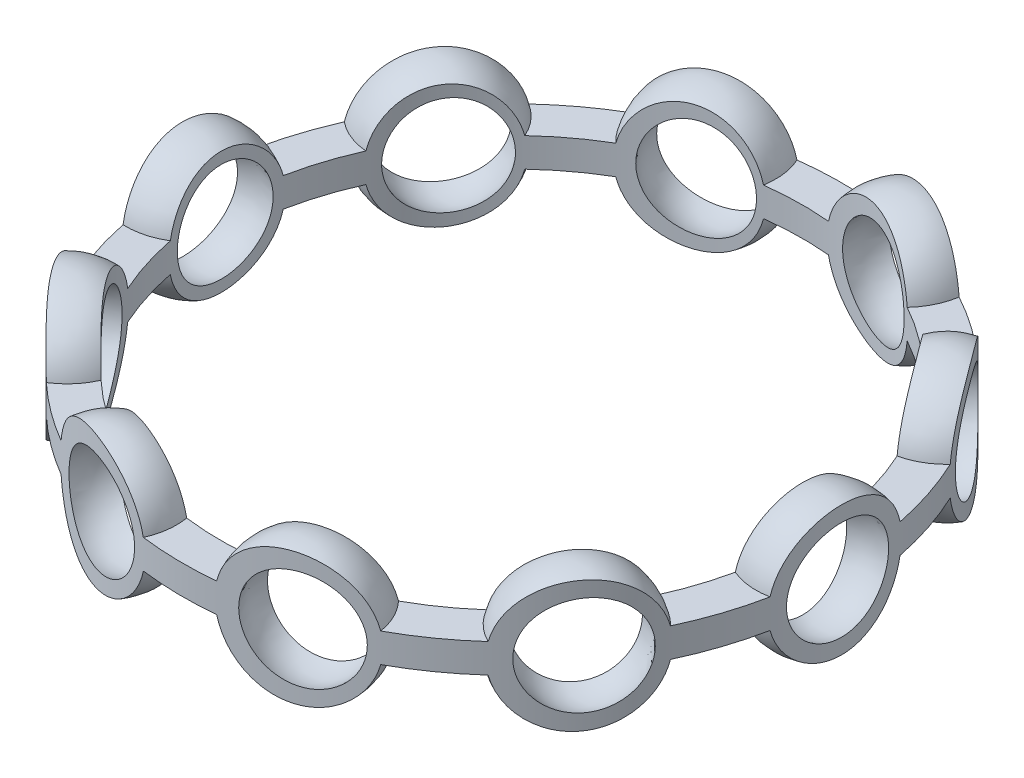
from build123d import *

# Parameters (mm, degrees)
SKETCH_1_R               = 27.5
EXTRUDE_1_DEPTH          = 0.75
PATTERN_CIRCULAR_1_COUNT = 10
SKETCH_5_OUTSIDE_W       = 72.62
SKETCH_5_OUTSIDE_H       = 72.62
SKETCH_5_OUTSIDE_R       = 17
SKETCH_5_OUTSIDE_R_2     = 15
CUT_EXTRUDE_1_DEPTH      = 5
PATTERN_CIRCULAR_2_COUNT = 10


with BuildPart() as part:
    # 草图1 → 凸台-拉伸1 (new, symmetric)
    with BuildSketch(Plane(origin=(0, 0, 0), x_dir=(1, 0, 0), z_dir=(0, 1, 0))):
        with Locations(Location((0, 0, 0), (0, 0, 270))):
            Circle(SKETCH_1_R)
    extrude(amount=EXTRUDE_1_DEPTH, both=True)

    # 草图2 → 旋转1 (revolve)
    with BuildSketch(Plane.XY):
        with BuildLine():
            Line((16, -3.5), (16, 3.5))
            ThreePointArc((16, 3.5), (19.5, 0), (16, -3.5))
        make_face()
    revolve_1 = revolve(axis=Axis((16, 5.957971318, 0), (0, -1, 0)))

    # 阵列(圆周)1: 旋转1 ×10 about axis
    pattern_circular_1_axis = Axis((-0.251154201, 0, 0), (0, 1, 0))
    for i in range(1, PATTERN_CIRCULAR_1_COUNT):
        add(revolve_1.rotate(pattern_circular_1_axis, i * 360 / PATTERN_CIRCULAR_1_COUNT))

    # 草图5 outside → 切除-拉伸1 (cut, symmetric)
    # profile 1 of 2: a face of its own
    with BuildSketch(Plane(origin=(0, 0, 0), x_dir=(1, 0, 0), z_dir=(0, 1, 0))):
        Rectangle(SKETCH_5_OUTSIDE_W, SKETCH_5_OUTSIDE_H)
        with Locations(Location((0, 0, 0), (0, 0, 275.671259703))):
            Circle(SKETCH_5_OUTSIDE_R, mode=Mode.SUBTRACT)
    # profile 2 of 2: a face of its own
    with BuildSketch(Plane(origin=(0, 0, 0), x_dir=(1, 0, 0), z_dir=(0, 1, 0))):
        with Locations(Location((0, 0, 0), (0, 0, 275.324261317))):
            Circle(SKETCH_5_OUTSIDE_R_2)
    extrude(amount=CUT_EXTRUDE_1_DEPTH, both=True, mode=Mode.SUBTRACT)

    # 草图6 → 切除-旋转1 (revolve, cut)
    with BuildSketch(Plane.XY):
        with BuildLine():
            Line((16, 2.75), (16, -2.75))
            ThreePointArc((16, -2.75), (18.75, 0), (16, 2.75))
        make_face()
    cut_revolve_1 = revolve(axis=Axis((16, 2.75, 0), (0, -1, 0)), mode=Mode.SUBTRACT)

    # 阵列(圆周)2: 切除-旋转1 ×10 about axis
    pattern_circular_2_axis = Axis((0, 0, 0), (0, 1, 0))
    for i in range(1, PATTERN_CIRCULAR_2_COUNT):
        add(cut_revolve_1.rotate(pattern_circular_2_axis, i * 360 / PATTERN_CIRCULAR_2_COUNT), mode=Mode.SUBTRACT)


solid = part.part
